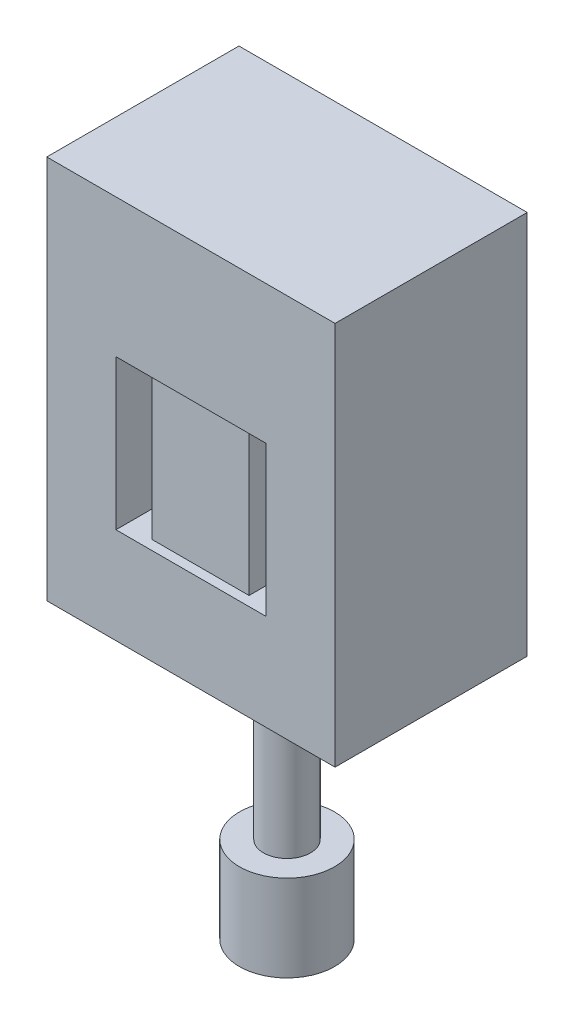
from build123d import *

# Parameters (mm, degrees)
SKETCH_1_W          = 30
SKETCH_1_H          = 20
EXTRUDE_1_DEPTH     = 40
SKETCH_2_R          = 2.45
EXTRUDE_2_DEPTH     = 19
SKETCH_3_R          = 4.95
EXTRUDE_3_DEPTH     = 9
SKETCH_4_W          = 15.6
SKETCH_4_H          = 15.6
CUT_EXTRUDE_1_DEPTH = 1
SKETCH_5_W          = 2.75
SKETCH_5_H          = 15.6
CUT_EXTRUDE_2_DEPTH = 3
FILLET_1_R          = 3


with BuildPart() as part:
    # 草图1 → 凸台-拉伸1 (new body)
    with BuildSketch(Plane(origin=(0, 0, 0), x_dir=(1, 0, 0), z_dir=(0, 1, 0))):
        Rectangle(SKETCH_1_W, SKETCH_1_H)
    extrude(amount=EXTRUDE_1_DEPTH)

    # 草图2 → 凸台-拉伸2 (add)
    with BuildSketch(Plane.XZ):
        with Locations(Location((0, 0, 0), (0, 0, 270))):
            Circle(SKETCH_2_R)
    extrude(amount=EXTRUDE_2_DEPTH)

    # 草图3 → 凸台-拉伸3 (add)
    with BuildSketch(Plane.XZ.offset(19)):
        with Locations(Location((0, 0, 0), (0, 0, 270))):
            Circle(SKETCH_3_R)
    extrude(amount=EXTRUDE_3_DEPTH)

    # 草图4 → 切除-拉伸1 (cut)
    with BuildSketch(Plane.XY.offset(10)):
        with Locations((0, 17.8)):
            Rectangle(SKETCH_4_W, SKETCH_4_H)
    extrude(amount=-CUT_EXTRUDE_1_DEPTH, mode=Mode.SUBTRACT)

    # 草图5 → 切除-拉伸2 (cut)
    with BuildSketch(Plane.XY.offset(9)):
        with Locations((-6.425, 17.8)):
            Rectangle(SKETCH_5_W, SKETCH_5_H)
        with Locations((6.425, 17.8)):
            Rectangle(SKETCH_5_W, SKETCH_5_H)
    extrude(amount=-CUT_EXTRUDE_2_DEPTH, mode=Mode.SUBTRACT)

    # 圆角1
    fillet_1_edges = [part.edges().sort_by_distance(p)[0] for p in [
        (0, 0, 2.45),
    ]]
    fillet(fillet_1_edges, radius=FILLET_1_R)


solid = part.part
